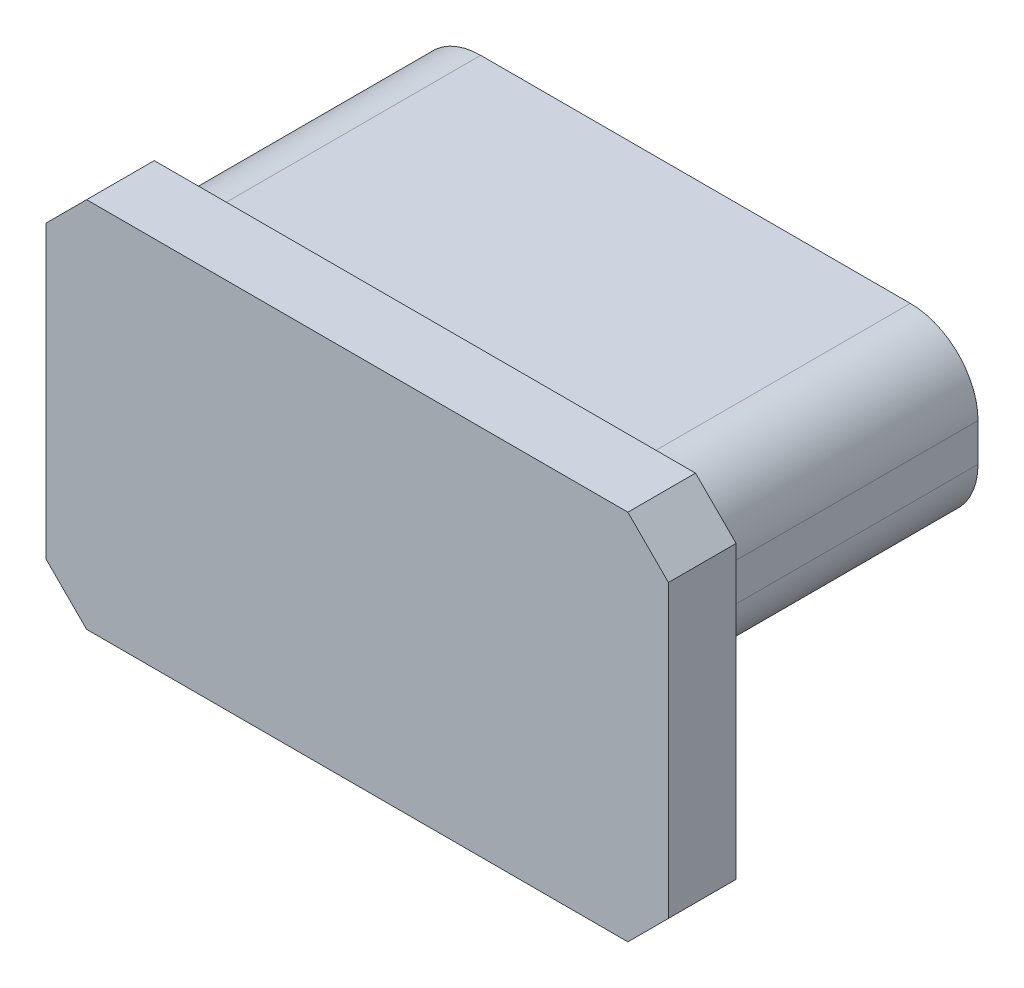
from build123d import *

# Parameters (mm, degrees)
BOSS_EXTRUDE1_DEPTH = 5
SKETCH2_W           = 9.2
SKETCH2_H           = 5.5
BOSS_EXTRUDE2_DEPTH = 1
CHAMFER1_SIZE       = 0.6


with BuildPart() as part:
    # Sketch1 → Boss-Extrude1 (new body)
    with BuildSketch(Plane.XY):
        with BuildLine():
            Line((-4.17, -0.3), (-1.3, -0.3))
            ThreePointArc((-1.3, -0.3), (-0.592893219, -0.592893219), (-0.3, -1.3))
            Line((-0.3, -1.3), (-0.3, -1.86))
            ThreePointArc((-0.3, -1.86), (-0.592893219, -2.567106781), (-1.3, -2.86))
            Line((-1.3, -2.86), (-7.65, -2.86))
            ThreePointArc((-7.65, -2.86), (-8.357106781, -2.567106781), (-8.65, -1.86))
            Line((-8.65, -1.86), (-8.65, -1.3))
            ThreePointArc((-8.65, -1.3), (-8.357106781, -0.592893219), (-7.65, -0.3))
            Line((-7.65, -0.3), (-4.17, -0.3))
        make_face()
    extrude(amount=BOSS_EXTRUDE1_DEPTH)

    # Sketch2 → Boss-Extrude2 (add)
    with BuildSketch(Plane.XY.offset(5)):
        with Locations((-4.475, -2.81)):
            Rectangle(SKETCH2_W, SKETCH2_H)
    extrude(amount=-BOSS_EXTRUDE2_DEPTH)

    # Chamfer1
    chamfer1_edges = [part.edges().sort_by_distance(p)[0] for p in [
        (0.125, -0.06, 4.5),
        (0.125, -5.56, 4.5),
        (-9.075, -5.56, 4.5),
        (-9.075, -0.06, 4.5),
    ]]
    chamfer(chamfer1_edges, length=CHAMFER1_SIZE)


solid = part.part
